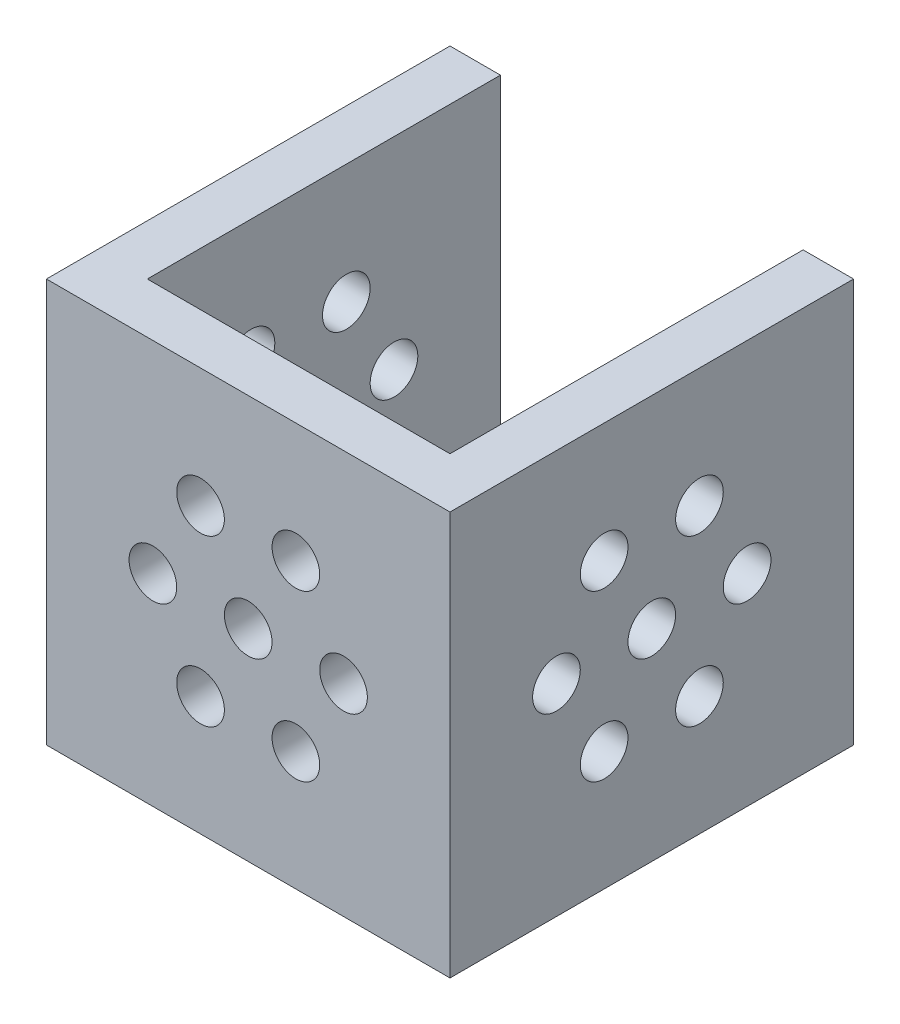
from build123d import *

# Parameters (mm, degrees)
BOSS_EXTRUDE1_DEPTH = 25.4
SKETCH3_R           = 1.5
CUT_EXTRUDE1_DEPTH  = 44.994090512
SKETCH4_R           = 1.5
CUT_EXTRUDE2_DEPTH  = 44.994090512


with BuildPart() as part:
    # Sketch2 → Boss-Extrude1 (new body)
    with BuildSketch(Plane(origin=(0, 0, 0), x_dir=(1, 0, 0), z_dir=(0, 1, 0))):
        Polygon((22.225, 3.175), (12.7, 3.175), (3.175, 3.175), (3.175, 25.4), (0, 25.4), (0, 0), (25.4, 0), (25.4, 25.4), (22.225, 25.4), align=None)
    extrude(amount=BOSS_EXTRUDE1_DEPTH)

    # Sketch3 → Cut-Extrude1 (cut, through all)
    with BuildSketch(Plane.XY):
        with Locations((12.7, 12.7)):
            Circle(SKETCH3_R)
        with Locations((6.7, 12.7)):
            Circle(SKETCH3_R)
        with Locations((9.7, 17.896152423)):
            Circle(SKETCH3_R)
        with Locations((15.7, 17.896152423)):
            Circle(SKETCH3_R)
        with Locations((18.7, 12.7)):
            Circle(SKETCH3_R)
        with Locations((15.7, 7.503847577)):
            Circle(SKETCH3_R)
        with Locations((9.7, 7.503847577)):
            Circle(SKETCH3_R)
    extrude(amount=-CUT_EXTRUDE1_DEPTH, mode=Mode.SUBTRACT)

    # Sketch4 → Cut-Extrude2 (cut, through all)
    with BuildSketch(Plane(origin=(25.4, 0, 0), x_dir=(0, 0, -1), z_dir=(1, 0, 0))):
        with Locations((12.7, 12.7)):
            Circle(SKETCH4_R)
        with Locations((6.7, 12.7)):
            Circle(SKETCH4_R)
        with Locations((9.7, 17.896152423)):
            Circle(SKETCH4_R)
        with Locations((15.7, 17.896152423)):
            Circle(SKETCH4_R)
        with Locations((18.7, 12.7)):
            Circle(SKETCH4_R)
        with Locations((15.7, 7.503847577)):
            Circle(SKETCH4_R)
        with Locations((9.7, 7.503847577)):
            Circle(SKETCH4_R)
    extrude(amount=-CUT_EXTRUDE2_DEPTH, mode=Mode.SUBTRACT)


solid = part.part
